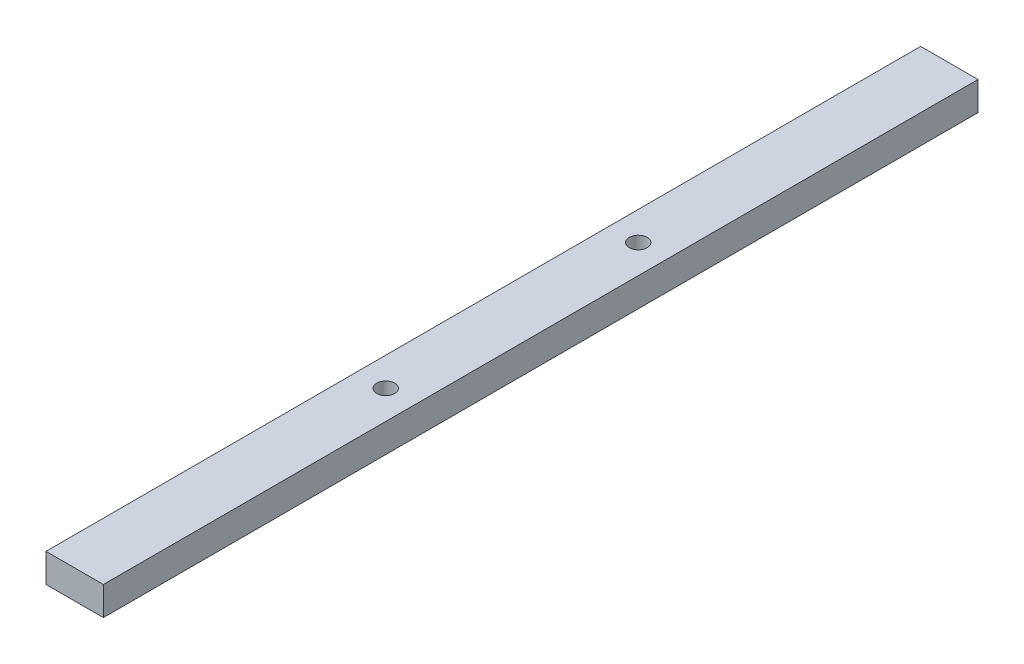
from build123d import *

# Parameters (mm, degrees)
SKETCH3_W           = 20
SKETCH3_H           = 10
BOSS_EXTRUDE1_DEPTH = 152.4
SKETCH4_R           = 3.125
CUT_EXTRUDE1_DEPTH  = 5


with BuildPart() as part:
    # Sketch3 → Boss-Extrude1 (new, symmetric)
    with BuildSketch(Plane.XY):
        Rectangle(SKETCH3_W, SKETCH3_H)
    extrude(amount=BOSS_EXTRUDE1_DEPTH, both=True)

    # Sketch4 → Cut-Extrude1 (cut, symmetric)
    with BuildSketch(Plane(origin=(0, 0, 0), x_dir=(1, 0, 0), z_dir=(0, 1, 0))):
        with Locations(Location((0, -44, 0), (0, 0, 270))):
            Circle(SKETCH4_R)
        with Locations(Location((0, 44, 0), (0, 0, 90))):
            Circle(SKETCH4_R)
    extrude(amount=CUT_EXTRUDE1_DEPTH, both=True, mode=Mode.SUBTRACT)


solid = part.part
